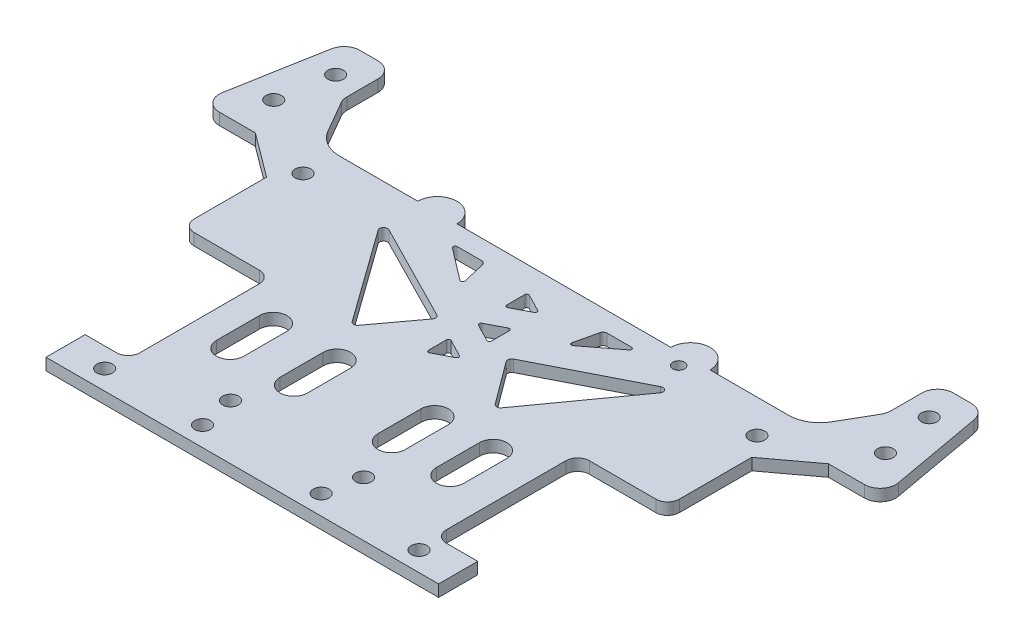
from build123d import *

# Parameters (mm, degrees)
SKETCH_2_R      = 2
SKETCH_2_R_2    = 1.5
EXTRUDE_2_DEPTH = 3


with BuildPart() as part:
    # 草图2 → 凸台-拉伸2 (new body)
    with BuildSketch(Plane(origin=(0, 0, 0), x_dir=(1, 0, 0), z_dir=(0, 1, 0))):
        with BuildLine():
            Line((-50, 0), (50, 0))
            Line((50, 0), (50, 10))
            Line((50, 10), (42, 10))
            ThreePointArc((42, 10), (39.878679656, 10.878679656), (39, 13))
            Line((39, 13), (39, 43.53))
            ThreePointArc((39, 43.53), (39.878679656, 45.651320344), (42, 46.53))
            Line((42, 46.53), (59, 46.53))
            ThreePointArc((59, 46.53), (61.121320344, 47.408679656), (62, 49.53))
            Line((62, 49.53), (62, 68.03))
            Line((62, 68.03), (73.21965962, 76.403723067))
            Line((73.21965962, 76.403723067), (82.431106141, 76.403723067))
            ThreePointArc((82.431106141, 76.403723067), (85.500981678, 77.839378281), (86.367215806, 81.115790975))
            Line((86.367215806, 81.115790975), (82.094808358, 104.732448965))
            ThreePointArc((82.094808358, 104.732448965), (80.723043479, 107.090256594), (78.158698693, 108.020381057))
            Line((78.158698693, 108.020381057), (73.5, 108.020381057))
            ThreePointArc((73.5, 108.020381057), (70.671572875, 106.848808182), (69.5, 104.020381057))
            Line((69.5, 104.020381057), (69.5, 96.092177826))
            ThreePointArc((69.5, 96.092177826), (69.363703305, 95.056901646), (68.964101615, 94.092177826))
            Line((68.964101615, 94.092177826), (64.309401077, 86.03))
            ThreePointArc((64.309401077, 86.03), (61.381197846, 83.10179677), (57.381197846, 82.03))
            Line((57.381197846, 82.03), (37.34, 82.03))
            ThreePointArc((37.34, 82.03), (32.34, 87.03), (27.34, 82.03))
            Line((27.34, 82.03), (-27.34, 82.03))
            ThreePointArc((-27.34, 82.03), (-32.34, 87.03), (-37.34, 82.03))
            Line((-37.34, 82.03), (-57.381197846, 82.03))
            ThreePointArc((-57.381197846, 82.03), (-61.381197846, 83.10179677), (-64.309401077, 86.03))
            Line((-64.309401077, 86.03), (-68.964101615, 94.092177826))
            ThreePointArc((-68.964101615, 94.092177826), (-69.363703305, 95.056901646), (-69.5, 96.092177826))
            Line((-69.5, 96.092177826), (-69.5, 104.020381057))
            ThreePointArc((-69.5, 104.020381057), (-70.671572875, 106.848808182), (-73.5, 108.020381057))
            Line((-73.5, 108.020381057), (-78.158698693, 108.020381057))
            ThreePointArc((-78.158698693, 108.020381057), (-80.723043479, 107.090256594), (-82.094808358, 104.732448965))
            Line((-82.094808358, 104.732448965), (-86.367215806, 81.115790975))
            ThreePointArc((-86.367215806, 81.115790975), (-85.500981678, 77.839378281), (-82.431106141, 76.403723067))
            Line((-82.431106141, 76.403723067), (-73.21965962, 76.403723067))
            Line((-73.21965962, 76.403723067), (-62, 68.03))
            Line((-62, 68.03), (-62, 49.53))
            ThreePointArc((-62, 49.53), (-61.121320344, 47.408679656), (-59, 46.53))
            Line((-59, 46.53), (-42.32, 46.53))
            ThreePointArc((-42.32, 46.53), (-40.198679656, 45.651320344), (-39.32, 43.53))
            Line((-39.32, 43.53), (-39.32, 13))
            ThreePointArc((-39.32, 13), (-40.198679656, 10.878679656), (-42.32, 10))
            Line((-42.32, 10), (-50.32, 10))
            Line((-50.32, 10), (-50.32, 0))
            Line((-50.32, 0), (-50, 0))
        make_face()
        with Locations(Location((40, 5, 0), (0, 0, 270))):
            Circle(SKETCH_2_R, mode=Mode.SUBTRACT)
        with Locations(Location((15, 5, 0), (0, 0, 270))):
            Circle(SKETCH_2_R, mode=Mode.SUBTRACT)
        with Locations(Location((57.84, 73.5, 0), (0, 0, 270))):
            Circle(SKETCH_2_R, mode=Mode.SUBTRACT)
        with Locations(Location((16.84, 14, 0), (0, 0, 270))):
            Circle(SKETCH_2_R, mode=Mode.SUBTRACT)
        with Locations(Location((78.158698693, 86.03, 0), (0, 0, 270))):
            Circle(SKETCH_2_R, mode=Mode.SUBTRACT)
        with Locations(Location((75.829349346, 99.527249228, 0), (0, 0, 270))):
            Circle(SKETCH_2_R, mode=Mode.SUBTRACT)
        with Locations(Location((-75.829349346, 99.527249228, 0), (0, 0, 90))):
            Circle(SKETCH_2_R, mode=Mode.SUBTRACT)
        with Locations(Location((-78.158698693, 86.03, 0), (0, 0, 90))):
            Circle(SKETCH_2_R, mode=Mode.SUBTRACT)
        with Locations(Location((-58.16, 73.5, 0), (0, 0, 90))):
            Circle(SKETCH_2_R, mode=Mode.SUBTRACT)
        with Locations(Location((-40.32, 5, 0), (0, 0, 90))):
            Circle(SKETCH_2_R, mode=Mode.SUBTRACT)
        with Locations(Location((-15.32, 5, 0), (0, 0, 90))):
            Circle(SKETCH_2_R, mode=Mode.SUBTRACT)
        with Locations(Location((-17.16, 14, 0), (0, 0, 270))):
            Circle(SKETCH_2_R, mode=Mode.SUBTRACT)
        with Locations(Location((32.34, 79, 0), (0, 0, 270))):
            Circle(SKETCH_2_R_2, mode=Mode.SUBTRACT)
        with BuildLine():
            Line((9, 25.5), (9, 36.5))
            ThreePointArc((9, 36.5), (12.5, 40), (16, 36.5))
            Line((16, 36.5), (16, 25.5))
            ThreePointArc((16, 25.5), (12.5, 22), (9, 25.5))
        make_face(mode=Mode.SUBTRACT)
        with BuildLine():
            Line((-9, 25.5), (-9, 36.5))
            ThreePointArc((-9, 36.5), (-12.5, 40), (-16, 36.5))
            Line((-16, 36.5), (-16, 25.5))
            ThreePointArc((-16, 25.5), (-12.5, 22), (-9, 25.5))
        make_face(mode=Mode.SUBTRACT)
        with BuildLine():
            Line((-25.272016313, 36.5), (-25.272016313, 25.5))
            ThreePointArc((-25.272016313, 25.5), (-28.772016313, 22), (-32.272016313, 25.5))
            Line((-32.272016313, 25.5), (-32.272016313, 36.5))
            ThreePointArc((-32.272016313, 36.5), (-28.772016313, 40), (-25.272016313, 36.5))
        make_face(mode=Mode.SUBTRACT)
        with BuildLine():
            Line((30.95778596, 36.5), (30.95778596, 25.5))
            ThreePointArc((30.95778596, 25.5), (27.45778596, 22), (23.95778596, 25.5))
            Line((23.95778596, 25.5), (23.95778596, 36.5))
            ThreePointArc((23.95778596, 36.5), (27.45778596, 40), (30.95778596, 36.5))
        make_face(mode=Mode.SUBTRACT)
        with BuildLine():
            Line((-34.733908774, 72.03), (-9.783415342, 59.322802138))
            ThreePointArc((-9.783415342, 59.322802138), (-9.263833402, 58.660781037), (-9.43365707, 57.836525462))
            Line((-9.43365707, 57.836525462), (-17.468690008, 46.988104116))
            ThreePointArc((-17.468690008, 46.988104116), (-18.279638575, 46.58331884), (-19.084539505, 47))
            Line((-19.084539505, 47), (-36, 70.555619208))
            ThreePointArc((-36, 70.555619208), (-35.946399549, 71.790395058), (-34.733908774, 72.03))
        make_face(mode=Mode.SUBTRACT)
        with BuildLine():
            Line((-22.298560337, 77.03), (-15.998560337, 77.03))
            ThreePointArc((-15.998560337, 77.03), (-15.376941046, 76.813319511), (-15.024707298, 76.257178913))
            Line((-15.024707298, 76.257178913), (-13.661633817, 70.41406068))
            ThreePointArc((-13.661633817, 70.41406068), (-13.87719951, 69.880514914), (-14.452198523, 69.903225894))
            Line((-14.452198523, 69.903225894), (-22.602198523, 76.13275467))
            ThreePointArc((-22.602198523, 76.13275467), (-22.77217551, 76.690276846), (-22.298560337, 77.03))
        make_face(mode=Mode.SUBTRACT)
        with BuildLine():
            Line((9.43365707, 57.836525462), (17.468690008, 46.988104116))
            ThreePointArc((17.468690008, 46.988104116), (18.279638575, 46.58331884), (19.084539505, 47))
            Line((19.084539505, 47), (36, 70.555619208))
            ThreePointArc((36, 70.555619208), (35.946399549, 71.790395058), (34.733908774, 72.03))
            Line((34.733908774, 72.03), (9.783415342, 59.322802138))
            ThreePointArc((9.783415342, 59.322802138), (9.263833402, 58.660781037), (9.43365707, 57.836525462))
        make_face(mode=Mode.SUBTRACT)
        with BuildLine():
            Line((14.452198523, 69.903225894), (22.602198523, 76.13275467))
            ThreePointArc((22.602198523, 76.13275467), (22.77217551, 76.690276846), (22.298560337, 77.03))
            Line((22.298560337, 77.03), (15.998560337, 77.03))
            ThreePointArc((15.998560337, 77.03), (15.376941046, 76.813319511), (15.024707298, 76.257178913))
            Line((15.024707298, 76.257178913), (13.661633817, 70.41406068))
            ThreePointArc((13.661633817, 70.41406068), (13.87719951, 69.880514914), (14.452198523, 69.903225894))
        make_face(mode=Mode.SUBTRACT)
        with BuildLine():
            Line((-3.013275549, 75.03), (-3.013275549, 70.43))
            ThreePointArc((-3.013275549, 70.43), (-2.77308317, 70.002799813), (-2.283275549, 69.986040542))
            Line((-2.283275549, 69.986040542), (2.156319027, 72.286040542))
            ThreePointArc((2.156319027, 72.286040542), (2.426319027, 72.73), (2.156319027, 73.173959458))
            Line((2.156319027, 73.173959458), (-2.283275549, 75.473959458))
            ThreePointArc((-2.283275549, 75.473959458), (-2.77308317, 75.457200187), (-3.013275549, 75.03))
        make_face(mode=Mode.SUBTRACT)
        with BuildLine():
            Line((3.013275549, 65.085839579), (3.013275549, 60.485839579))
            ThreePointArc((3.013275549, 60.485839579), (2.77308317, 60.058639392), (2.283275549, 60.041880121))
            Line((2.283275549, 60.041880121), (-2.156319027, 62.341880121))
            ThreePointArc((-2.156319027, 62.341880121), (-2.426319027, 62.785839579), (-2.156319027, 63.229799037))
            Line((-2.156319027, 63.229799037), (2.283275549, 65.529799037))
            ThreePointArc((2.283275549, 65.529799037), (2.77308317, 65.513039766), (3.013275549, 65.085839579))
        make_face(mode=Mode.SUBTRACT)
        with BuildLine():
            Line((-2.283275549, 49.986040542), (2.156319027, 52.286040542))
            ThreePointArc((2.156319027, 52.286040542), (2.426319027, 52.73), (2.156319027, 53.173959458))
            Line((2.156319027, 53.173959458), (-2.283275549, 55.473959458))
            ThreePointArc((-2.283275549, 55.473959458), (-2.77308317, 55.457200187), (-3.013275549, 55.03))
            Line((-3.013275549, 55.03), (-3.013275549, 50.43))
            ThreePointArc((-3.013275549, 50.43), (-2.77308317, 50.002799813), (-2.283275549, 49.986040542))
        make_face(mode=Mode.SUBTRACT)
    extrude(amount=EXTRUDE_2_DEPTH)


solid = part.part
